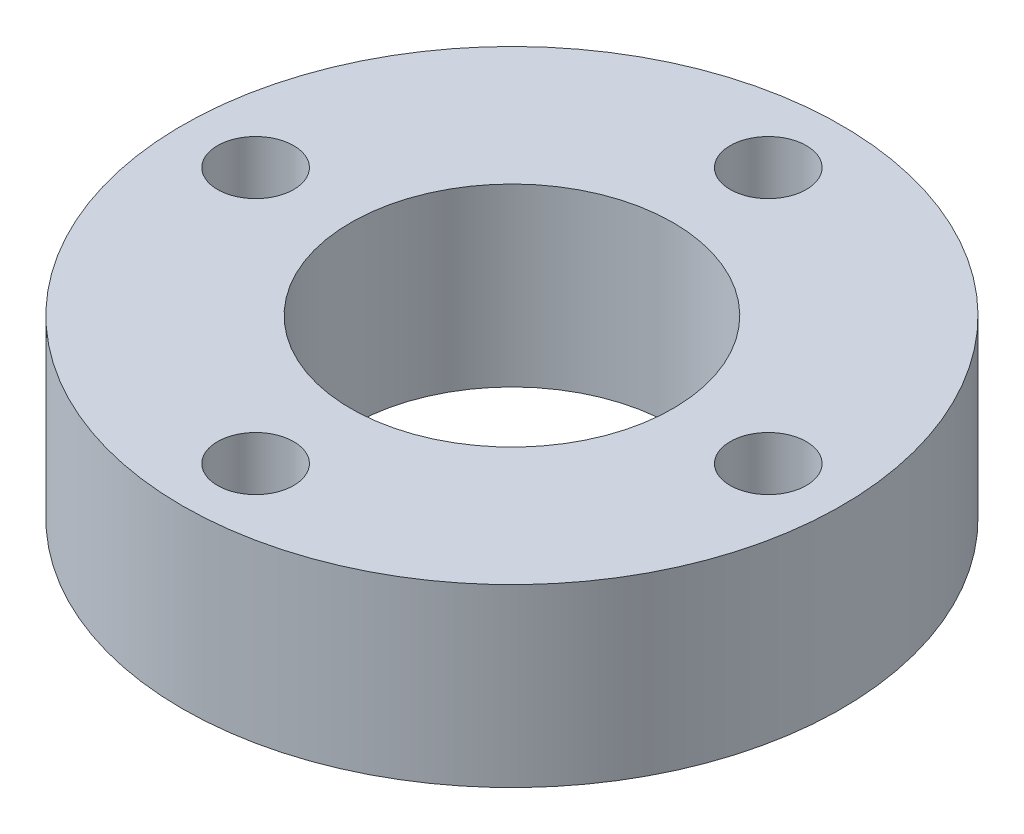
from build123d import *

# Parameters (mm, degrees)
SKETCH_1_R          = 22.5
EXTRUDE_1_DEPTH     = 12
SKETCH_2_R          = 4.2
CUT_EXTRUDE_1_DEPTH = 4.4
SKETCH_3_R          = 2.6
CUT_EXTRUDE_2_DEPTH = 35.007352146
SKETCH_4_R          = 4
CUT_EXTRUDE_3_DEPTH = 35.007352146
SKETCH_5_R          = 11
CUT_EXTRUDE_4_DEPTH = 35.007352146


with BuildPart() as part:
    # 草图1 → 凸台-拉伸1 (new body)
    with BuildSketch(Plane(origin=(0, 0, 0), x_dir=(1, 0, 0), z_dir=(0, 1, 0))):
        with Locations(Location((0, 0, 0), (0, 0, 270))):
            Circle(SKETCH_1_R)
    extrude(amount=EXTRUDE_1_DEPTH)

    # 草图2 → 切除-拉伸1 (cut)
    with BuildSketch(Plane.XZ):
        with Locations(Location((17.5, 0, 0), (0, 0, 270))):
            Circle(SKETCH_2_R)
        with Locations(Location((0, 17.5, 0), (0, 0, 270))):
            Circle(SKETCH_2_R)
        with Locations(Location((-17.5, 0, 0), (0, 0, 270))):
            Circle(SKETCH_2_R)
        with Locations(Location((0, -17.5, 0), (0, 0, 270))):
            Circle(SKETCH_2_R)
    extrude(amount=-CUT_EXTRUDE_1_DEPTH, mode=Mode.SUBTRACT)

    # 草图3 → 切除-拉伸2 (cut, through all)
    with BuildSketch(Plane.XZ):
        with Locations(Location((0, 17.5, 0), (0, 0, 270))):
            Circle(SKETCH_3_R)
        with Locations(Location((17.5, 0, 0), (0, 0, 270))):
            Circle(SKETCH_3_R)
        with Locations(Location((0, -17.5, 0), (0, 0, 270))):
            Circle(SKETCH_3_R)
        with Locations(Location((-17.5, 0, 0), (0, 0, 270))):
            Circle(SKETCH_3_R)
    extrude(amount=-CUT_EXTRUDE_2_DEPTH, mode=Mode.SUBTRACT)

    # 草图4 → 切除-拉伸3 (cut, through all)
    with BuildSketch(Plane.XZ):
        with Locations(Location((0, 0, 0), (0, 0, 270))):
            Circle(SKETCH_4_R)
    extrude(amount=-CUT_EXTRUDE_3_DEPTH, mode=Mode.SUBTRACT)

    # 草图5 → 切除-拉伸4 (cut, through all)
    with BuildSketch(Plane.XZ):
        with Locations(Location((0, 0, 0), (0, 0, 270))):
            Circle(SKETCH_5_R)
    extrude(amount=-CUT_EXTRUDE_4_DEPTH, mode=Mode.SUBTRACT)


solid = part.part
